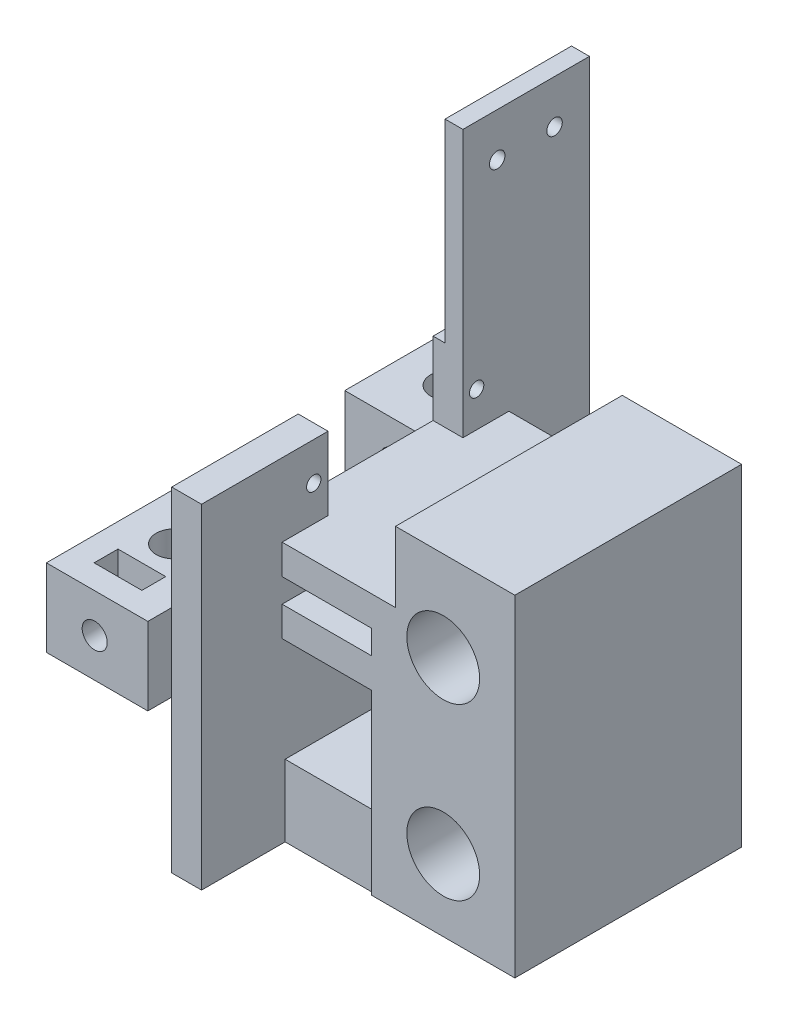
from build123d import *

# Parameters (mm, degrees)
SKETCH1_W                = 24
SKETCH1_H                = 52.5
SKETCH1_R                = 6.1
BOSS_EXTRUDE1_DEPTH      = 13.5
BOSS_EXTRUDE2_DEPTH      = 3
BOSS_EXTRUDE2_DEPTH_BACK = 2
SKETCH3_W                = 27
SKETCH3_H                = 18
BOSS_EXTRUDE3_DEPTH      = 15
SKETCH4_W                = 32
SKETCH4_H                = 12
CUT_EXTRUDE2_DEPTH       = 18
SKETCH6_W                = 65
SKETCH6_H                = 56
BOSS_EXTRUDE4_DEPTH      = 22
SKETCH7_R                = 3.1
CUT_EXTRUDE3_DEPTH       = 75.573788961
SKETCH8_W                = 17
SKETCH8_H                = 65
CUT_EXTRUDE4_DEPTH       = 17.5
SKETCH11_W               = 22.6
SKETCH11_H               = 12.25
CUT_EXTRUDE6_DEPTH       = 5
SKETCH12_W               = 17
SKETCH12_H               = 27
CUT_EXTRUDE7_DEPTH       = 63.5099992
SKETCH13_W               = 17
SKETCH13_H               = 65
CUT_EXTRUDE8_DEPTH       = 25.5
SKETCH16_W               = 15
SKETCH16_H               = 27
CUT_EXTRUDE9_DEPTH       = 6
BOSS_EXTRUDE5_DEPTH      = 5
BOSS_EXTRUDE5_DEPTH_BACK = 32
SKETCH17_W               = 15
SKETCH17_H               = 12
SKETCH19_W               = 21
SKETCH19_H               = 27
BOSS_EXTRUDE6_DEPTH      = 3.05
SKETCH20_W               = 1
SKETCH20_H               = 11.8
CUT_EXTRUDE11_DEPTH      = 67.106448248
SKETCH21_R               = 1.2
CUT_EXTRUDE12_DEPTH      = 10
SKETCH23_W               = 17
SKETCH23_H               = 13
BOSS_EXTRUDE7_DEPTH      = 4
SKETCH24_W               = 17
SKETCH24_H               = 13
BOSS_EXTRUDE8_DEPTH      = 4
SKETCH25_R               = 2.1
CUT_EXTRUDE14_DEPTH      = 88.080781462
SKETCH26_W               = 8
SKETCH26_H               = 4
CUT_EXTRUDE15_DEPTH      = 65.679981504
SKETCH27_W               = 3
SKETCH27_H               = 21.2
BOSS_EXTRUDE9_DEPTH      = 32.5
SKETCH28_R               = 1.3
CUT_EXTRUDE16_DEPTH      = 84.494386039
SKETCH30_W               = 15
SKETCH30_H               = 14
BOSS_EXTRUDE11_DEPTH     = 2
SKETCH31_R               = 6.1
BOSS_EXTRUDE13_DEPTH     = 5.5
BOSS_EXTRUDE14_START     = 5.5
SKETCH32_R               = 6.1
BOSS_EXTRUDE14_DEPTH     = 5.5


with BuildPart() as part:
    # Sketch1 → Boss-Extrude1 (new, symmetric)
    with BuildSketch(Plane.XY):
        with Locations((12, 0)):
            Rectangle(SKETCH1_W, SKETCH1_H)
        with Locations((12, 14.25)):
            Circle(SKETCH1_R, mode=Mode.SUBTRACT)
        with Locations(Location((12, -14.25, 0), (0, 0, 180))):
            Circle(SKETCH1_R, mode=Mode.SUBTRACT)
    extrude(amount=BOSS_EXTRUDE1_DEPTH, both=True)

    # Sketch2 → Boss-Extrude2 (add, two sides: drawn at the far end of the back side and taken through both)
    # profile 1 of 2: a face of its own
    with BuildSketch(Plane(origin=(0, 5.5, 0), x_dir=(1, 0, 0), z_dir=(0, 1, 0)).offset(-BOSS_EXTRUDE2_DEPTH_BACK)):
        Polygon((-4, -7), (0, -7), (0, -19), (-15, -19), (-15, -7), (-11, -7), align=None)
        with BuildLine():
            Line((-11.25, -12), (-3.75, -12))
            ThreePointArc((-3.75, -12), (-2.25, -13.5), (-3.75, -15))
            Line((-3.75, -15), (-11.25, -15))
            ThreePointArc((-11.25, -15), (-12.75, -13.5), (-11.25, -12))
        make_face(mode=Mode.SUBTRACT)
    # profile 2 of 2: a face of its own
    with BuildSketch(Plane(origin=(0, 5.5, 0), x_dir=(1, 0, 0), z_dir=(0, 1, 0)).offset(-BOSS_EXTRUDE2_DEPTH_BACK)):
        Polygon((-4, 7), (-11, 7), (-15, 7), (-15, 19), (0, 19), (0, 7), align=None)
        with BuildLine():
            ThreePointArc((-3.75, 12), (-2.25, 13.5), (-3.75, 15))
            Line((-3.75, 15), (-11.25, 15))
            ThreePointArc((-11.25, 15), (-12.75, 13.5), (-11.25, 12))
            Line((-11.25, 12), (-3.75, 12))
        make_face(mode=Mode.SUBTRACT)
    extrude(amount=BOSS_EXTRUDE2_DEPTH + BOSS_EXTRUDE2_DEPTH_BACK)

    # Sketch3 → Boss-Extrude3 (add)
    with BuildSketch(Plane.ZY):
        Polygon((13.5, 26.25), (-13.5, 26.25), (-13.5, 12.5), (-12, 12.5), (8.75, 12.5), (13.5, 12.5), align=None)
        Polygon((8.75, 12.5), (-12, 12.5), (-12, 8.5), (-7, 8.5), (-7, 5.5), (7, 5.5), (7, 8.5), (8.75, 8.5), align=None)
        with Locations((0, -17.25)):
            Rectangle(SKETCH3_W, SKETCH3_H)
    extrude(amount=BOSS_EXTRUDE3_DEPTH)

    # Sketch4 → Cut-Extrude2 (cut)
    with BuildSketch(Plane.ZY.offset(15)):
        with Locations((0, 23.5)):
            Rectangle(SKETCH4_W, SKETCH4_H)
    extrude(amount=-CUT_EXTRUDE2_DEPTH, mode=Mode.SUBTRACT)

    # Sketch6 → Boss-Extrude4 (add)
    with BuildSketch(Plane.ZY.offset(15)):
        with Locations((0, 1.75)):
            Rectangle(SKETCH6_W, SKETCH6_H)
    extrude(amount=BOSS_EXTRUDE4_DEPTH)

    # Sketch7 → Cut-Extrude3 (cut, through all)
    with BuildSketch(Plane(origin=(0, 29.75, 0), x_dir=(1, 0, 0), z_dir=(0, 1, 0))):
        with Locations(Location((-29, 23, 0), (0, 0, 270))):
            Circle(SKETCH7_R)
        with Locations(Location((-29, -23, 0), (0, 0, 270))):
            Circle(SKETCH7_R)
    extrude(amount=-CUT_EXTRUDE3_DEPTH, mode=Mode.SUBTRACT)

    # Sketch8 → Cut-Extrude4 (cut)
    with BuildSketch(Plane(origin=(0, 29.75, 0), x_dir=(1, 0, 0), z_dir=(0, 1, 0))):
        with Locations((-28.5, 0)):
            Rectangle(SKETCH8_W, SKETCH8_H)
    extrude(amount=-CUT_EXTRUDE4_DEPTH, mode=Mode.SUBTRACT)

    # Sketch11 → Cut-Extrude6 (cut)
    with BuildSketch(Plane.ZY.offset(20)):
        with Locations((0, 23.625)):
            Rectangle(SKETCH11_W, SKETCH11_H)
    extrude(amount=-CUT_EXTRUDE6_DEPTH, mode=Mode.SUBTRACT)

    # Sketch12 → Cut-Extrude7 (cut, through all)
    with BuildSketch(Plane(origin=(0, 12.25, 0), x_dir=(1, 0, 0), z_dir=(0, 1, 0))):
        with Locations((-28.5, 0)):
            Rectangle(SKETCH12_W, SKETCH12_H)
    extrude(amount=-CUT_EXTRUDE7_DEPTH, mode=Mode.SUBTRACT)

    # Sketch13 → Cut-Extrude8 (cut)
    with BuildSketch(Plane.XZ.offset(26.25)):
        with Locations((-28.5, 0)):
            Rectangle(SKETCH13_W, SKETCH13_H)
    extrude(amount=-CUT_EXTRUDE8_DEPTH, mode=Mode.SUBTRACT)

    # Sketch16 → Cut-Extrude9 (cut)
    with BuildSketch(Plane(origin=(0, -8.25, 0), x_dir=(1, 0, 0), z_dir=(0, 1, 0))):
        with Locations((-7.5, 0)):
            Rectangle(SKETCH16_W, SKETCH16_H)
    extrude(amount=-CUT_EXTRUDE9_DEPTH, mode=Mode.SUBTRACT)

    # Sketch17 → Boss-Extrude5 (add, two sides: drawn at the far end of the back side and taken through both)
    with BuildSketch(Plane(origin=(0, 0, -13.5), x_dir=(-1, 0, 0), z_dir=(0, 0, -1)).offset(-BOSS_EXTRUDE5_DEPTH_BACK)):
        with Locations((7.5, -20.25)):
            Rectangle(SKETCH17_W, SKETCH17_H)
    extrude(amount=BOSS_EXTRUDE5_DEPTH + BOSS_EXTRUDE5_DEPTH_BACK)

    # Sketch19 → Boss-Extrude6 (add)
    with BuildSketch(Plane(origin=(0, 26.25, 0), x_dir=(1, 0, 0), z_dir=(0, 1, 0))):
        with Locations((13.5, 0)):
            Rectangle(SKETCH19_W, SKETCH19_H)
    extrude(amount=BOSS_EXTRUDE6_DEPTH)

    # Sketch20 → Cut-Extrude11 (cut, through all)
    with BuildSketch(Plane.XY.offset(13.5)):
        with Locations((3.5, 23.4)):
            Rectangle(SKETCH20_W, SKETCH20_H)
    extrude(amount=-CUT_EXTRUDE11_DEPTH, mode=Mode.SUBTRACT)

    # Sketch21 → Cut-Extrude12 (cut)
    with BuildSketch(Plane(origin=(-15, 0, 0), x_dir=(0, 0, -1), z_dir=(1, 0, 0))):
        with Locations((-13.7, 23.4)):
            Circle(SKETCH21_R)
        with Locations((13.6, 23.4)):
            Circle(SKETCH21_R)
    extrude(amount=-CUT_EXTRUDE12_DEPTH, mode=Mode.SUBTRACT)

    # Sketch23 → Boss-Extrude7 (add)
    with BuildSketch(Plane(origin=(0, 0, -32.5), x_dir=(-1, 0, 0), z_dir=(0, 0, -1))):
        with Locations((28.5, 5.75)):
            Rectangle(SKETCH23_W, SKETCH23_H)
    extrude(amount=BOSS_EXTRUDE7_DEPTH)

    # Sketch24 → Boss-Extrude8 (add)
    with BuildSketch(Plane.XY.offset(32.5)):
        with Locations((-28.5, 5.75)):
            Rectangle(SKETCH24_W, SKETCH24_H)
    extrude(amount=BOSS_EXTRUDE8_DEPTH)

    # Sketch25 → Cut-Extrude14 (cut, through all)
    with BuildSketch(Plane(origin=(0, 0, -36.5), x_dir=(-1, 0, 0), z_dir=(0, 0, -1))):
        with Locations((28.902210775, 5.75)):
            Circle(SKETCH25_R)
    extrude(amount=-CUT_EXTRUDE14_DEPTH, mode=Mode.SUBTRACT)

    # Sketch26 → Cut-Extrude15 (cut, through all)
    with BuildSketch(Plane(origin=(0, 12.25, 0), x_dir=(1, 0, 0), z_dir=(0, 1, 0))):
        with Locations((-29, -30.5)):
            Rectangle(SKETCH26_W, SKETCH26_H)
        with Locations((-29, 30.5)):
            Rectangle(SKETCH26_W, SKETCH26_H)
    extrude(amount=-CUT_EXTRUDE15_DEPTH, mode=Mode.SUBTRACT)

    # Sketch27 → Boss-Extrude9 (add)
    with BuildSketch(Plane(origin=(0, 29.75, 0), x_dir=(1, 0, 0), z_dir=(0, 1, 0))):
        with Locations((-16.5, 21.9)):
            Rectangle(SKETCH27_W, SKETCH27_H)
    extrude(amount=BOSS_EXTRUDE9_DEPTH)

    # Sketch28 → Cut-Extrude16 (cut, through all)
    with BuildSketch(Plane.ZY.offset(18)):
        with Locations((-26.65, 54.95)):
            Circle(SKETCH28_R)
        with Locations((-17.05, 54.95)):
            Circle(SKETCH28_R)
    extrude(amount=-CUT_EXTRUDE16_DEPTH, mode=Mode.SUBTRACT)

    # Sketch30 → Boss-Extrude11 (add)
    with BuildSketch(Plane.XZ.offset(-5.5)):
        with Locations((-7.5, 0)):
            Rectangle(SKETCH30_W, SKETCH30_H)
    extrude(amount=BOSS_EXTRUDE11_DEPTH)

    # Sketch31 → Boss-Extrude13 (add)
    with BuildSketch(Plane.XY.offset(13.5)):
        Polygon((24, 29.3), (4, 29.3), (4, 17.5), (-15, 17.5), (-15, 12.5), (0, 12.5), (0, 8.5), (0, 3.5), (0, -14.25), (0, -26.25), (24, -26.25), align=None)
        with Locations(Location((12, -14.25, 0), (0, 0, 180))):
            Circle(SKETCH31_R, mode=Mode.SUBTRACT)
        with Locations((12, 14.25)):
            Circle(SKETCH31_R, mode=Mode.SUBTRACT)
    extrude(amount=BOSS_EXTRUDE13_DEPTH)

    # Sketch32 → Boss-Extrude14 (add)
    with BuildSketch(Plane(origin=(0, 0, -13.5), x_dir=(-1, 0, 0), z_dir=(0, 0, -1)).offset(BOSS_EXTRUDE14_START)):
        Polygon((-4, 17.5), (-4, 29.3), (-24, 29.3), (-24, -26.25), (0, -26.25), (0, -14.25), (0, 3.5), (0, 8.5), (0, 12.5), (15, 12.5), (15, 17.5), align=None)
        with Locations((-12, -14.25)):
            Circle(SKETCH32_R, mode=Mode.SUBTRACT)
        with Locations((-12, 14.25)):
            Circle(SKETCH32_R, mode=Mode.SUBTRACT)
    extrude(amount=-BOSS_EXTRUDE14_DEPTH)


solid = part.part
